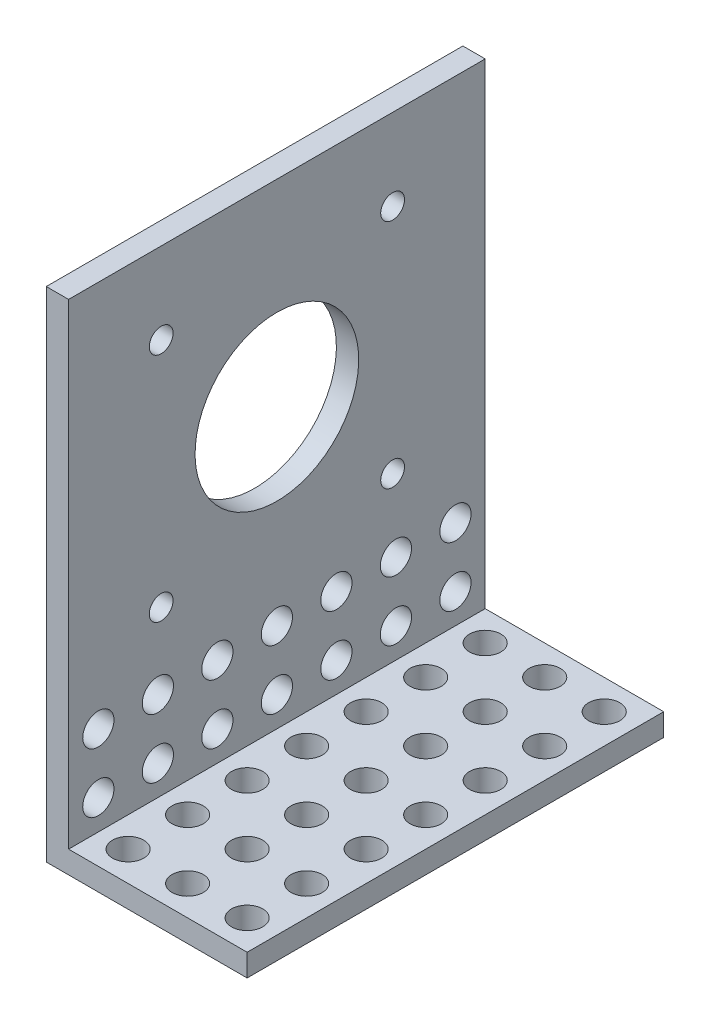
from build123d import *

# Parameters (mm, degrees)
EXTRU_MINCE1_DEPTH              = 28
ESQUISSE2_R                     = 2.1
ENL_V_MAT_EXTRU_1_DEPTH         = 74.86474125
R_P_TITION_LIN_AIRE1_COUNT      = 3
R_P_TITION_LIN_AIRE1_PITCH      = 8
R_P_TITION_LIN_AIRE1_COUNT_DIR2 = 7
R_P_TITION_LIN_AIRE1_PITCH_DIR2 = 8
ESQUISSE3_R                     = 2.1
ENL_V_MAT_EXTRU_2_DEPTH         = 74.86474125
R_P_TITION_LIN_AIRE2_COUNT      = 2
R_P_TITION_LIN_AIRE2_PITCH      = 8
R_P_TITION_LIN_AIRE2_COUNT_DIR2 = 7
R_P_TITION_LIN_AIRE2_PITCH_DIR2 = 8
ESQUISSE4_R                     = 11
ENL_V_MAT_EXTRU_3_DEPTH         = 74.86474125
ESQUISSE5_R                     = 1.6
ENL_V_MAT_EXTRU_4_DEPTH         = 74.86474125
R_P_TITION_CIRCULAIRE1_COUNT    = 4


with BuildPart() as part:
    # Esquisse1 → Extru.-Mince1 (new, symmetric)
    with BuildSketch(Plane.XY):
        Polygon((0, 64), (0, 0), (24, 0), (24, -3), (-3, -3), (-3, 64), align=None)
    extrude(amount=EXTRU_MINCE1_DEPTH, both=True)

    # Esquisse2 → Enlèv. mat.-Extru.1 (cut, through all)
    with BuildSketch(Plane(origin=(0, 0, 0), x_dir=(1, 0, 0), z_dir=(0, 1, 0))):
        with Locations(Location((4, -24, 0), (0, 0, 270))):
            Circle(ESQUISSE2_R)
    enl_v_mat_extru_1 = extrude(amount=-ENL_V_MAT_EXTRU_1_DEPTH, mode=Mode.SUBTRACT)

    # Répétition linéaire1: Enl_v. mat.-Extru.1 3 × 7
    with Locations(*[(i * R_P_TITION_LIN_AIRE1_PITCH, 0, -j * R_P_TITION_LIN_AIRE1_PITCH_DIR2) for i in range(R_P_TITION_LIN_AIRE1_COUNT) for j in range(R_P_TITION_LIN_AIRE1_COUNT_DIR2) if (i, j) != (0, 0)]):
        add(enl_v_mat_extru_1, mode=Mode.SUBTRACT)

    # Esquisse3 → Enlèv. mat.-Extru.2 (cut, through all)
    with BuildSketch(Plane(origin=(0, 0, 0), x_dir=(0, 0, -1), z_dir=(1, 0, 0))):
        with Locations(Location((-24, 4, 0), (0, 0, 90))):
            Circle(ESQUISSE3_R)
    enl_v_mat_extru_2 = extrude(amount=-ENL_V_MAT_EXTRU_2_DEPTH, mode=Mode.SUBTRACT)

    # Répétition linéaire2: Enl_v. mat.-Extru.2 2 × 7
    with Locations(*[(0, i * R_P_TITION_LIN_AIRE2_PITCH, -j * R_P_TITION_LIN_AIRE2_PITCH_DIR2) for i in range(R_P_TITION_LIN_AIRE2_COUNT) for j in range(R_P_TITION_LIN_AIRE2_COUNT_DIR2) if (i, j) != (0, 0)]):
        add(enl_v_mat_extru_2, mode=Mode.SUBTRACT)

    # Esquisse4 → Enlèv. mat.-Extru.3 (cut, through all)
    with BuildSketch(Plane(origin=(0, 0, 0), x_dir=(0, 0, -1), z_dir=(1, 0, 0))):
        with Locations(Location((0, 37.5, 0), (0, 0, 90))):
            Circle(ESQUISSE4_R)
    extrude(amount=-ENL_V_MAT_EXTRU_3_DEPTH, mode=Mode.SUBTRACT)

    # Esquisse5 → Enlèv. mat.-Extru.4 (cut, through all)
    with BuildSketch(Plane(origin=(0, 0, 0), x_dir=(0, 0, -1), z_dir=(1, 0, 0))):
        with Locations(Location((-15.556349186, 53.056349186, 0), (0, 0, 90))):
            Circle(ESQUISSE5_R)
    enl_v_mat_extru_4 = extrude(amount=-ENL_V_MAT_EXTRU_4_DEPTH, mode=Mode.SUBTRACT)

    # Répétition circulaire1: Enlèv. mat.-Extru.4 ×4 about axis
    r_p_tition_circulaire1_axis = Axis((0, 37.5, 0), (1, 0, 0))
    for i in range(1, R_P_TITION_CIRCULAIRE1_COUNT):
        add(enl_v_mat_extru_4.rotate(r_p_tition_circulaire1_axis, i * 360 / R_P_TITION_CIRCULAIRE1_COUNT), mode=Mode.SUBTRACT)


solid = part.part
